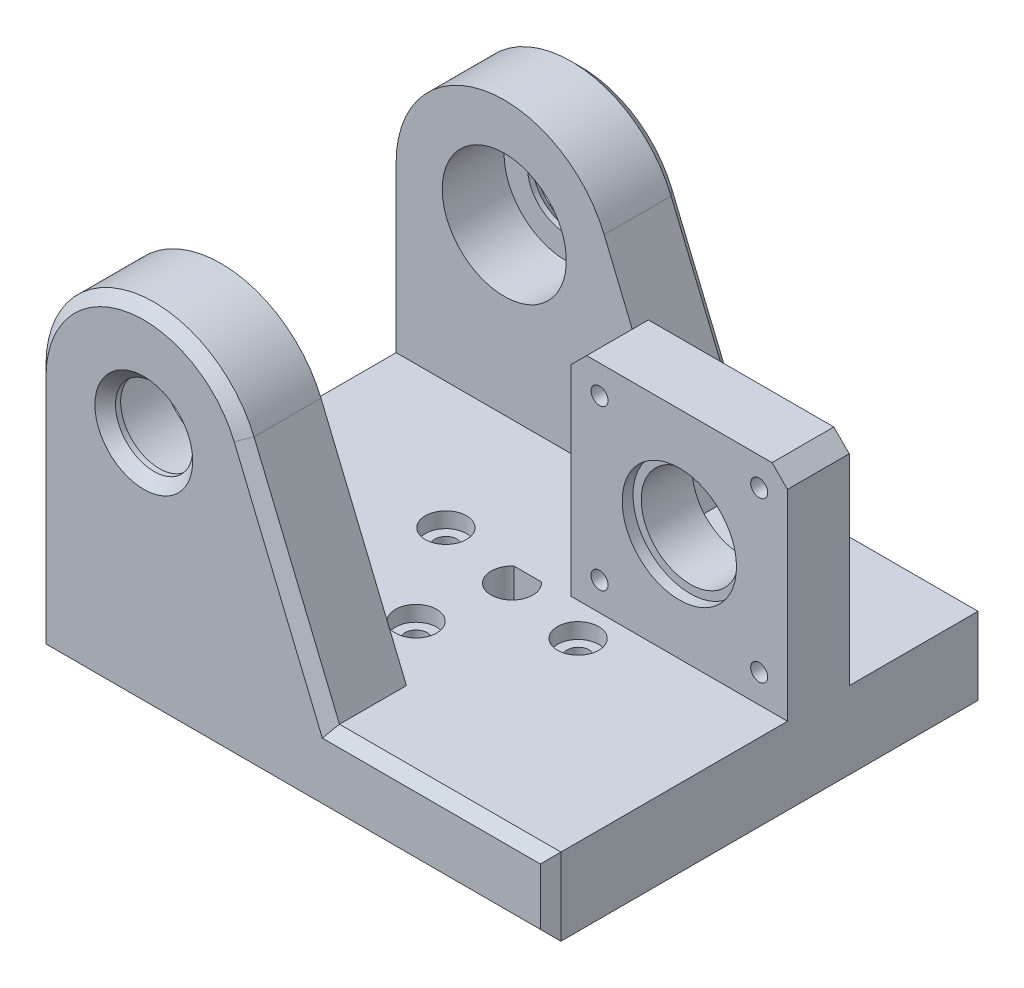
from build123d import *

# Parameters (mm, degrees)
SKETCH_1_W               = 100
SKETCH_1_H               = 85
EXTRUDE_1_DEPTH          = 15
EXTRUDE_2_DEPTH          = 15
EXTRUDE_START            = -27
SKETCH_3_W               = 42
SKETCH_3_H               = 42
EXTRUDE_3_DEPTH          = 12
CHAMFER_1_SIZE           = 3
EXTRUDE_START_2          = -15
EXTRUDE_4_DEPTH          = 15
SKETCH_6_R               = 27.5
EXTRUDE_5_DEPTH          = 23
SKETCH_7_R               = 24
EXTRUDE_6_DEPTH          = 7
SKETCH_8_R               = 12.5
EXTRUDE_7_DEPTH          = 7
SKETCH_9_R               = 9.5
CUT_EXTRUDE_1_DEPTH      = 15
SKETCH_11_R              = 27.5
EXTRUDE_9_DEPTH          = 2
CUT_EXTRUDE_2_DEPTH      = 39.5
CUT_EXTRUDE_2_DEPTH_BACK = 39.5
SKETCH_12_R              = 12.05
SKETCH_13_R              = 7.5
CUT_EXTRUDE_3_DEPTH      = 120.787311515
CHAMFER_2_SIZE           = 2
CHAMFER_3_SIZE           = 2
CUT_EXTRUDE_START        = -3.5
SKETCH_10_R              = 39
SKETCH_10_R_2            = 27.5
CUT_EXTRUDE_4_DEPTH      = 3.5
SKETCH_15_R              = 1.65
CUT_EXTRUDE_5_DEPTH      = 97.124918726
SKETCH_16_W              = 105.441549674
SKETCH_16_H              = 43.677503156
CUT_EXTRUDE_6_DEPTH      = 120.787311515
CUT_EXTRUDE_7_DEPTH      = 95.5
CUT_EXTRUDE_7_DEPTH_BACK = 95.5
SKETCH_17_R              = 2.15
SKETCH_18_R              = 4
CUT_EXTRUDE_8_DEPTH      = 3
CUT_EXTRUDE_9_DEPTH      = 85.351941294
SKETCH_20_R              = 11.1
CUT_EXTRUDE_10_DEPTH     = 2.1
EXTRUDE_START_3          = -12
EXTRUDE_10_DEPTH         = 18


with BuildPart() as part:
    # 草图1 → 凸台-拉伸1 (new body)
    with BuildSketch(Plane(origin=(0, 0, 0), x_dir=(1, 0, 0), z_dir=(0, 1, 0))):
        Rectangle(SKETCH_1_W, SKETCH_1_H)
    extrude(amount=EXTRUDE_1_DEPTH)

    # 草图2 → 凸台-拉伸2 (add)
    with BuildSketch(Plane.XY.offset(42.5)):
        with BuildLine():
            Line((-50, 15), (-50, 47))
            ThreePointArc((-50, 47), (-33.100173908, 67.595838753), (-9.601088198, 55.042525778))
            Line((-9.601088198, 55.042525778), (7, 15))
            Line((7, 15), (-50, 15))
        make_face()
    extrude(amount=-EXTRUDE_2_DEPTH)

    # 草图3 → 凸台-拉伸3 (add)
    with BuildSketch(Plane(origin=(0, 0, -42.5), x_dir=(-1, 0, 0), z_dir=(0, 0, -1)).offset(EXTRUDE_START)):
        with Locations((-29, 36)):
            Rectangle(SKETCH_3_W, SKETCH_3_H)
    extrude(amount=-EXTRUDE_3_DEPTH)

    # 倒角1
    chamfer_1_edges = [part.edges().sort_by_distance(p)[0] for p in [
        (50, 57, -9.5),
        (8, 57, -9.5),
    ]]
    chamfer(chamfer_1_edges, length=CHAMFER_1_SIZE)

    # 草图5 → 凸台-拉伸4 (add)
    with BuildSketch(Plane(origin=(0, 0, -42.5), x_dir=(-1, 0, 0), z_dir=(0, 0, -1)).offset(EXTRUDE_START_2)):
        with BuildLine():
            Line((-7, 15), (50, 15))
            Line((50, 15), (50, 47))
            ThreePointArc((50, 47), (33.100173908, 67.595838753), (9.601088198, 55.042525778))
            Line((9.601088198, 55.042525778), (-7, 15))
        make_face()
    extrude(amount=EXTRUDE_4_DEPTH)

    # 草图6 → 凸台-拉伸5 (add)
    with BuildSketch(Plane.XZ):
        with Locations(Location((0, 0, 0), (0, 0, 270))):
            Circle(SKETCH_6_R)
    extrude(amount=EXTRUDE_5_DEPTH)

    # 草图7 → 凸台-拉伸6 (add)
    with BuildSketch(Plane.XZ.offset(23)):
        with Locations(Location((0, 0, 0), (0, 0, 270))):
            Circle(SKETCH_7_R)
    extrude(amount=EXTRUDE_6_DEPTH)

    # 草图8 → 凸台-拉伸7 (add)
    with BuildSketch(Plane.XZ.offset(30)):
        with Locations(Location((0, 0, 0), (0, 0, 270))):
            Circle(SKETCH_8_R)
    extrude(amount=EXTRUDE_7_DEPTH)

    # 草图9 → 切除-拉伸1 (cut)
    with BuildSketch(Plane(origin=(0, 0, -15.5), x_dir=(-1, 0, 0), z_dir=(0, 0, -1))):
        with Locations((-29, 36)):
            Circle(SKETCH_9_R)
    extrude(amount=-CUT_EXTRUDE_1_DEPTH, mode=Mode.SUBTRACT)

    # 草图11 → 凸台-拉伸9 (add)
    with BuildSketch(Plane.XZ.offset(30)):
        with Locations(Location((0, 0, 0), (0, 0, 270))):
            Circle(SKETCH_11_R)
    extrude(amount=EXTRUDE_9_DEPTH)

    # 草图12 → 切除-拉伸2 (cut, two sides: drawn at the far end of the back side and taken through both)
    with BuildSketch(Plane.XY.offset(-CUT_EXTRUDE_2_DEPTH_BACK)):
        with Locations(Location((-29, 47, 0), (0, 0, 180))):
            Circle(SKETCH_12_R)
    extrude(amount=CUT_EXTRUDE_2_DEPTH + CUT_EXTRUDE_2_DEPTH_BACK, mode=Mode.SUBTRACT)

    # 草图13 → 切除-拉伸3 (cut, through all)
    with BuildSketch(Plane.XY.offset(42.5)):
        with Locations((-29, 47)):
            Circle(SKETCH_13_R)
    extrude(amount=-CUT_EXTRUDE_3_DEPTH, mode=Mode.SUBTRACT)

    # 倒角2
    chamfer_2_edges = [part.edges().sort_by_distance(p)[0] for p in [
        (-36.5, 47, 42.5),
        (28.5, 15, 42.5),
        (-1.300544099, 35.021262889, 42.5),
        (-33.100173908, 67.595838753, 42.5),
        (0, 0, 42.5),
        (50, 7.5, 42.5),
        (-50, 23.5, 42.5),
    ]]
    chamfer(chamfer_2_edges, length=CHAMFER_2_SIZE)

    # 倒角3
    chamfer_3_edges = [part.edges().sort_by_distance(p)[0] for p in [
        (0, 0, -42.5),
        (-1.300544099, 35.021262889, -42.5),
        (-33.100173908, 67.595838753, -42.5),
        (28.5, 15, -42.5),
        (-50, 23.5, -42.5),
        (50, 7.5, -42.5),
        (-36.5, 47, -42.5),
    ]]
    chamfer(chamfer_3_edges, length=CHAMFER_3_SIZE)

    # 草图10 → 切除-拉伸4 (cut)
    with BuildSketch(Plane.XZ.offset(CUT_EXTRUDE_START)):
        with Locations(Location((0, 0, 0), (0, 0, 270))):
            Circle(SKETCH_10_R)
        with Locations(Location((0, 0, 0), (0, 0, 270))):
            Circle(SKETCH_10_R_2, mode=Mode.SUBTRACT)
    extrude(amount=CUT_EXTRUDE_4_DEPTH, mode=Mode.SUBTRACT)

    # 草图15 → 切除-拉伸5 (cut, through all)
    with BuildSketch(Plane.XY.offset(-3.5)):
        with Locations((44.5, 51.5)):
            Circle(SKETCH_15_R)
        with Locations((13.5, 51.5)):
            Circle(SKETCH_15_R)
        with Locations((13.5, 20.5)):
            Circle(SKETCH_15_R)
        with Locations((44.5, 20.5)):
            Circle(SKETCH_15_R)
    extrude(amount=-CUT_EXTRUDE_5_DEPTH, mode=Mode.SUBTRACT)

    # 草图16 → 切除-拉伸6 (cut, through all)
    with BuildSketch(Plane(origin=(0, 0, -42.5), x_dir=(-1, 0, 0), z_dir=(0, 0, -1))):
        with Locations((2.720774837, -21.838751578)):
            Rectangle(SKETCH_16_W, SKETCH_16_H)
    extrude(amount=-CUT_EXTRUDE_6_DEPTH, mode=Mode.SUBTRACT)

    # 草图17 → 切除-拉伸7 (cut, two sides: drawn at the far end of the back side and taken through both)
    with BuildSketch(Plane(origin=(0, 0, 0), x_dir=(1, 0, 0), z_dir=(0, 1, 0)).offset(-CUT_EXTRUDE_7_DEPTH_BACK)):
        with Locations(Location((-2.898938749, -15.735188405, 0), (0, 0, 90))):
            Circle(SKETCH_17_R)
        with Locations(Location((-15.735188405, 2.898938749, 0), (0, 0, 90))):
            Circle(SKETCH_17_R)
        with Locations(Location((2.898938749, 15.735188405, 0), (0, 0, 90))):
            Circle(SKETCH_17_R)
        with Locations(Location((15.735188405, -2.898938749, 0), (0, 0, 90))):
            Circle(SKETCH_17_R)
    extrude(amount=CUT_EXTRUDE_7_DEPTH + CUT_EXTRUDE_7_DEPTH_BACK, mode=Mode.SUBTRACT)

    # 草图18 → 切除-拉伸8 (cut)
    with BuildSketch(Plane(origin=(0, 15, 0), x_dir=(1, 0, 0), z_dir=(0, 1, 0))):
        with Locations(Location((2.898938749, 15.735188405, 0), (0, 0, 270))):
            Circle(SKETCH_18_R)
        with Locations(Location((15.735188405, -2.898938749, 0), (0, 0, 270))):
            Circle(SKETCH_18_R)
        with Locations(Location((-2.898938749, -15.735188405, 0), (0, 0, 270))):
            Circle(SKETCH_18_R)
        with Locations(Location((-15.735188405, 2.898938749, 0), (0, 0, 270))):
            Circle(SKETCH_18_R)
    extrude(amount=-CUT_EXTRUDE_8_DEPTH, mode=Mode.SUBTRACT)

    # 草图19 → 切除-拉伸9 (cut, through all)
    with BuildSketch(Plane(origin=(0, 15, 0), x_dir=(1, 0, 0), z_dir=(0, 1, 0))):
        with BuildLine():
            Line((-2.664582519, 3.05), (2.664582519, 3.05))
            ThreePointArc((2.664582519, 3.05), (0, -4.05), (-2.664582519, 3.05))
        make_face()
    extrude(amount=-CUT_EXTRUDE_9_DEPTH, mode=Mode.SUBTRACT)

    # 草图20 → 切除-拉伸10 (cut)
    with BuildSketch(Plane.XY.offset(-3.5)):
        with Locations((29, 36)):
            Circle(SKETCH_20_R)
    extrude(amount=-CUT_EXTRUDE_10_DEPTH, mode=Mode.SUBTRACT)

    # 草图21 → 凸台-拉伸10 (add)
    with BuildSketch(Plane(origin=(50, 0, 0), x_dir=(0, 0, -1), z_dir=(1, 0, 0)).offset(EXTRUDE_START_3)):
        Polygon((15.5, 25), (15.5, 15), (25.5, 15), align=None)
    extrude(amount=-EXTRUDE_10_DEPTH)


solid = part.part
